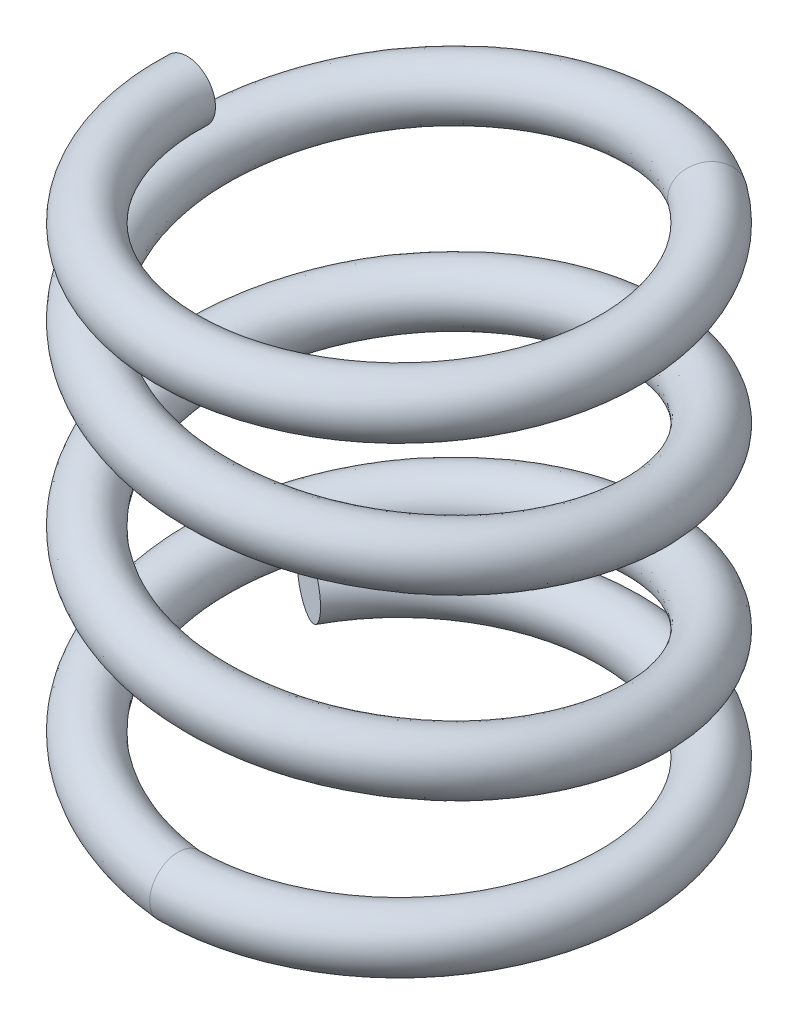
from build123d import *

# Parameters (mm, degrees)
SWEEP2_PITCH  = 2.5
SWEEP2_HEIGHT = 6.5
SWEEP2_RADIUS = 3.1
SKETCH3_R     = 0.4
SKETCH8_R     = 0.4
SKETCH10_R    = 0.4


with BuildPart() as part:
    # Sweep2: sweep along a helix
    with BuildLine() as sweep2_path:
        Helix(SWEEP2_PITCH, SWEEP2_HEIGHT, SWEEP2_RADIUS, center=(0, 0, 0), direction=(0, 1, 0), lefthand=True)
    # Sketch3 → Sweep2 (sweep)
    with BuildSketch(Plane(origin=(0, 0, 0), x_dir=(0, 0, -1), z_dir=(1, 0, 0))):
        with Locations((-3.1, 0)):
            Circle(SKETCH3_R)
    sweep(path=sweep2_path.line, is_frenet=True)

    # Sweep3: sweep along a path in Sketch7
    with BuildLine(Plane(origin=(0, 0, 0), x_dir=(1, 0, 0), z_dir=(0, 1, 0))) as sweep3_path:
        ThreePointArc((0, -3.1), (2.66036659, 1.591367213), (-2.731367849, 1.466161545))
    # Sketch8 → Sweep3 (sweep)
    with BuildSketch(Plane(origin=(0, 0, 0), x_dir=(0, 0, -1), z_dir=(1, 0, 0))):
        with Locations((-3.1, 0)):
            Circle(SKETCH8_R)
    sweep(path=sweep3_path.line)

    # Sweep4: sweep along a path in Sketch12
    with BuildLine(Plane(origin=(0, 6.5, 0), x_dir=(1, 0, 0), z_dir=(0, 1, 0))) as sweep4_path:
        ThreePointArc((1.822134282, 2.507952683), (1.345159897, -2.792945551), (-3.096890476, 0.138814181))
    # Sketch10 → Sweep4 (sweep)
    with BuildSketch(Plane(origin=(0, 0, 0), x_dir=(0.5877852522924729, -1.4650896681731835e-15, -0.8090169943749477), z_dir=(0.8090169943749477, 0, 0.5877852522924729))):
        with Locations((3.1, 6.5)):
            Circle(SKETCH10_R)
    sweep(path=sweep4_path.line)


solid = part.part
